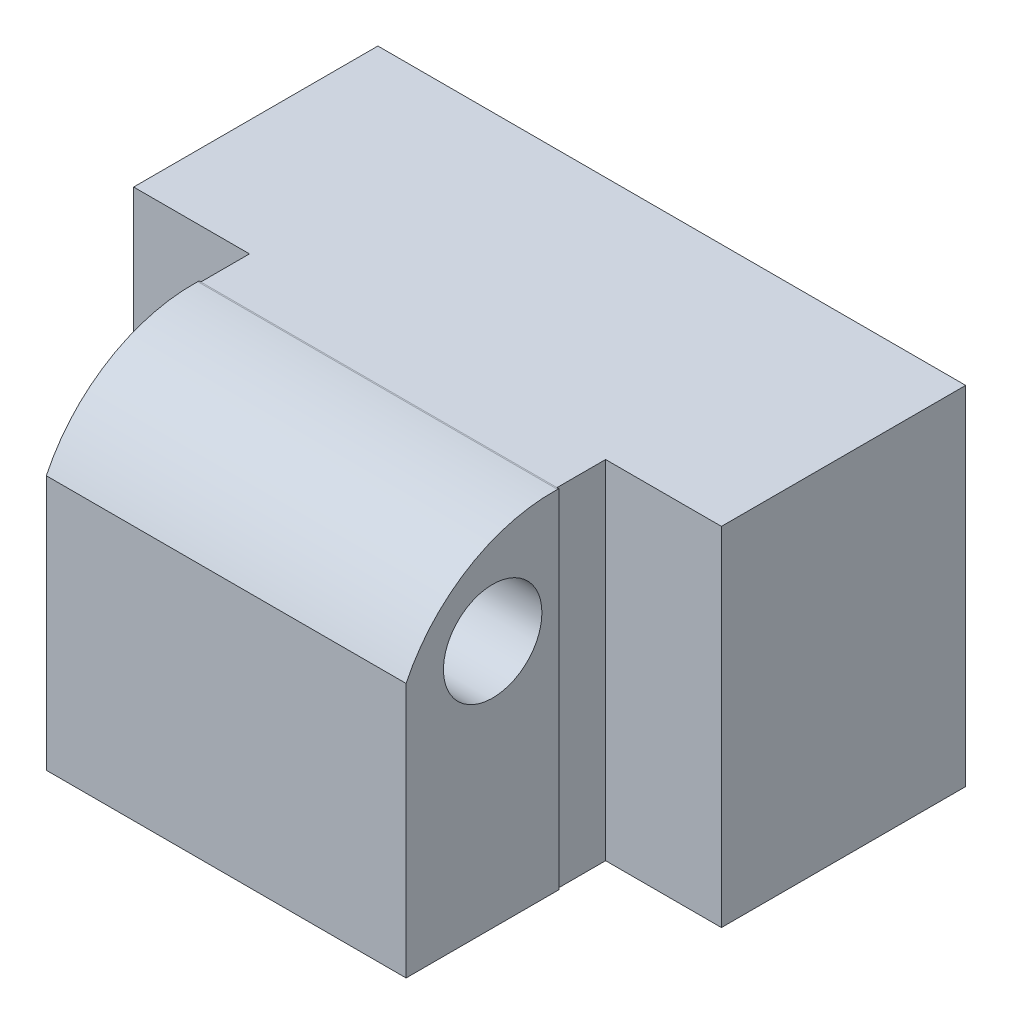
from build123d import *

# Parameters (mm, degrees)
BOSS_EXTRUDE1_DEPTH = 12
SKETCH2_R           = 1.7
BOSS_EXTRUDE2_DEPTH = 6.2125


with BuildPart() as part:
    # Sketch1 → Boss-Extrude1 (new body)
    with BuildSketch(Plane(origin=(0, 0, 0), x_dir=(1, 0, 0), z_dir=(0, 1, 0))):
        Polygon((10.15, -65.254427144), (6.15, -65.254427144), (6.15, -66.934427144), (-6.15, -66.934427144), (-6.15, -65.254427144), (-10.15, -65.254427144), (-10.15, -56.819346079), (10.15, -56.819346079), align=None)
    extrude(amount=BOSS_EXTRUDE1_DEPTH)

    # Sketch2 → Boss-Extrude2 (add, symmetric)
    with BuildSketch(Plane(origin=(0, 0, 0), x_dir=(0, 0, -1), z_dir=(1, 0, 0))):
        with BuildLine():
            Line((-72.207292933, 5.999665069), (-72.207292933, 8.809665069))
            ThreePointArc((-72.207292933, 8.809665069), (-70.065734946, 11.180872507), (-66.977292933, 11.999665069))
            Line((-66.977292933, 11.999665069), (-66.934427144, 12))
            Line((-66.934427144, 12), (-66.934427144, 0))
            Line((-66.934427144, 0), (-72.207292933, 0))
            Line((-72.207292933, 0), (-72.207292933, 5.999665069))
        make_face()
        with Locations((-69.217292933, 8.579665069)):
            Circle(SKETCH2_R, mode=Mode.SUBTRACT)
    extrude(amount=BOSS_EXTRUDE2_DEPTH, both=True)


solid = part.part
